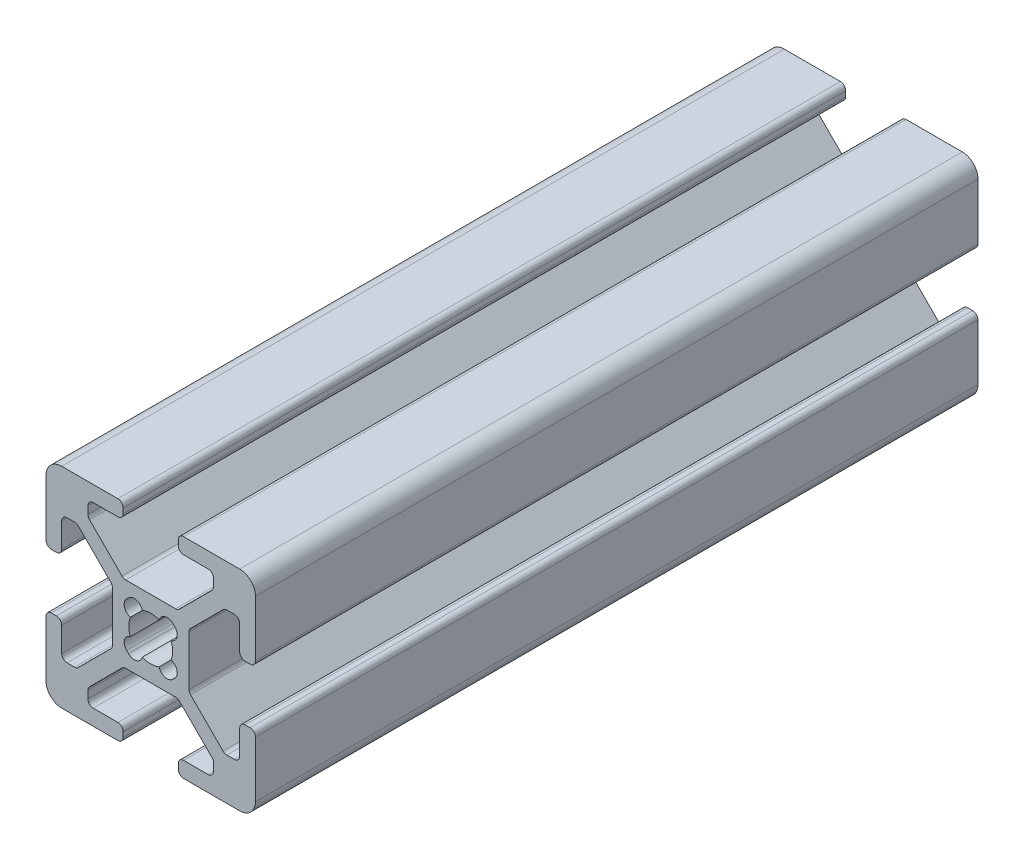
from build123d import *

# Parameters (mm, degrees)
BOSS_EXTRUDE1_DEPTH = 69


with BuildPart() as part:
    # Sketch2 → Boss-Extrude1 (new body)
    with BuildSketch(Plane.XY):
        with BuildLine():
            Line((-10, -3.138), (-10, -8.5))
            ThreePointArc((-10, -8.5), (-9.560660172, -9.560660172), (-8.5, -10))
            Line((-8.5, -10), (-3.138, -10))
            ThreePointArc((-3.138, -10), (-2.778789755, -9.851210245), (-2.63, -9.492))
            Line((-2.63, -9.492), (-2.63, -9.008))
            ThreePointArc((-2.63, -9.008), (-2.778789755, -8.648789755), (-3.138, -8.5))
            Line((-3.138, -8.5), (-5.487, -8.5))
            ThreePointArc((-5.487, -8.5), (-5.846210245, -8.351210245), (-5.995, -7.992))
            Line((-5.995, -7.992), (-5.995, -7.266240833))
            ThreePointArc((-5.995, -7.266240833), (-5.956330803, -7.07183765), (-5.846210245, -6.907030588))
            Line((-5.846210245, -6.907030588), (-2.742969412, -3.803789755))
            ThreePointArc((-2.742969412, -3.803789755), (-2.57816235, -3.693669197), (-2.383759167, -3.655))
            Line((-2.383759167, -3.655), (2.38407951, -3.655))
            ThreePointArc((2.38407951, -3.655), (2.578482694, -3.693669197), (2.743289755, -3.803789755))
            Line((2.743289755, -3.803789755), (5.846210245, -6.906710245))
            ThreePointArc((5.846210245, -6.906710245), (5.956330803, -7.071517306), (5.995, -7.26592049))
            Line((5.995, -7.26592049), (5.995, -7.992))
            ThreePointArc((5.995, -7.992), (5.846210245, -8.351210245), (5.487, -8.5))
            Line((5.487, -8.5), (3.138, -8.5))
            ThreePointArc((3.138, -8.5), (2.778789755, -8.648789755), (2.63, -9.008))
            Line((2.63, -9.008), (2.63, -9.492))
            ThreePointArc((2.63, -9.492), (2.778789755, -9.851210245), (3.138, -10))
            Line((3.138, -10), (8.5, -10))
            ThreePointArc((8.5, -10), (9.560660172, -9.560660172), (10, -8.5))
            Line((10, -8.5), (10, -3.138))
            ThreePointArc((10, -3.138), (9.851210245, -2.778789755), (9.492, -2.63))
            Line((9.492, -2.63), (9.008, -2.63))
            ThreePointArc((9.008, -2.63), (8.648789755, -2.778789755), (8.5, -3.138))
            Line((8.5, -3.138), (8.5, -5.487))
            ThreePointArc((8.5, -5.487), (8.351210245, -5.846210245), (7.992, -5.995))
            Line((7.992, -5.995), (7.266240833, -5.995))
            ThreePointArc((7.266240833, -5.995), (7.07183765, -5.956330803), (6.907030588, -5.846210245))
            Line((6.907030588, -5.846210245), (3.803789755, -2.742969412))
            ThreePointArc((3.803789755, -2.742969412), (3.693669197, -2.57816235), (3.655, -2.383759167))
            Line((3.655, -2.383759167), (3.655, 2.38407951))
            ThreePointArc((3.655, 2.38407951), (3.693669197, 2.578482694), (3.803789755, 2.743289755))
            Line((3.803789755, 2.743289755), (6.906710245, 5.846210245))
            ThreePointArc((6.906710245, 5.846210245), (7.071517306, 5.956330803), (7.26592049, 5.995))
            Line((7.26592049, 5.995), (7.992, 5.995))
            ThreePointArc((7.992, 5.995), (8.351210245, 5.846210245), (8.5, 5.487))
            Line((8.5, 5.487), (8.5, 3.138))
            ThreePointArc((8.5, 3.138), (8.648789755, 2.778789755), (9.008, 2.63))
            Line((9.008, 2.63), (9.492, 2.63))
            ThreePointArc((9.492, 2.63), (9.851210245, 2.778789755), (10, 3.138))
            Line((10, 3.138), (10, 8.5))
            ThreePointArc((10, 8.5), (9.560660172, 9.560660172), (8.5, 10))
            Line((8.5, 10), (3.138, 10))
            ThreePointArc((3.138, 10), (2.778789755, 9.851210245), (2.63, 9.492))
            Line((2.63, 9.492), (2.63, 9.008))
            ThreePointArc((2.63, 9.008), (2.778789755, 8.648789755), (3.138, 8.5))
            Line((3.138, 8.5), (5.487, 8.5))
            ThreePointArc((5.487, 8.5), (5.846210245, 8.351210245), (5.995, 7.992))
            Line((5.995, 7.992), (5.995, 7.266240833))
            ThreePointArc((5.995, 7.266240833), (5.956330803, 7.07183765), (5.846210245, 6.907030588))
            Line((5.846210245, 6.907030588), (2.742969412, 3.803789755))
            ThreePointArc((2.742969412, 3.803789755), (2.57816235, 3.693669197), (2.383759167, 3.655))
            Line((2.383759167, 3.655), (-2.38407951, 3.655))
            ThreePointArc((-2.38407951, 3.655), (-2.578482694, 3.693669197), (-2.743289755, 3.803789755))
            Line((-2.743289755, 3.803789755), (-5.846210245, 6.906710245))
            ThreePointArc((-5.846210245, 6.906710245), (-5.956330803, 7.071517306), (-5.995, 7.26592049))
            Line((-5.995, 7.26592049), (-5.995, 7.992))
            ThreePointArc((-5.995, 7.992), (-5.846210245, 8.351210245), (-5.487, 8.5))
            Line((-5.487, 8.5), (-3.138, 8.5))
            ThreePointArc((-3.138, 8.5), (-2.778789755, 8.648789755), (-2.63, 9.008))
            Line((-2.63, 9.008), (-2.63, 9.492))
            ThreePointArc((-2.63, 9.492), (-2.778789755, 9.851210245), (-3.138, 10))
            Line((-3.138, 10), (-8.5, 10))
            ThreePointArc((-8.5, 10), (-9.560660172, 9.560660172), (-10, 8.5))
            Line((-10, 8.5), (-10, 3.138))
            ThreePointArc((-10, 3.138), (-9.851210245, 2.778789755), (-9.492, 2.63))
            Line((-9.492, 2.63), (-9.008, 2.63))
            ThreePointArc((-9.008, 2.63), (-8.648789755, 2.778789755), (-8.5, 3.138))
            Line((-8.5, 3.138), (-8.5, 5.487))
            ThreePointArc((-8.5, 5.487), (-8.351210245, 5.846210245), (-7.992, 5.995))
            Line((-7.992, 5.995), (-7.266240833, 5.995))
            ThreePointArc((-7.266240833, 5.995), (-7.07183765, 5.956330803), (-6.907030588, 5.846210245))
            Line((-6.907030588, 5.846210245), (-3.803789755, 2.742969412))
            ThreePointArc((-3.803789755, 2.742969412), (-3.693669197, 2.57816235), (-3.655, 2.383759167))
            Line((-3.655, 2.383759167), (-3.655, -2.38407951))
            ThreePointArc((-3.655, -2.38407951), (-3.693669197, -2.578482694), (-3.803789755, -2.743289755))
            Line((-3.803789755, -2.743289755), (-6.906710245, -5.846210245))
            ThreePointArc((-6.906710245, -5.846210245), (-7.071517306, -5.956330803), (-7.26592049, -5.995))
            Line((-7.26592049, -5.995), (-7.992, -5.995))
            ThreePointArc((-7.992, -5.995), (-8.351210245, -5.846210245), (-8.5, -5.487))
            Line((-8.5, -5.487), (-8.5, -3.138))
            ThreePointArc((-8.5, -3.138), (-8.648789755, -2.778789755), (-9.008, -2.63))
            Line((-9.008, -2.63), (-9.492, -2.63))
            ThreePointArc((-9.492, -2.63), (-9.851210245, -2.778789755), (-10, -3.138))
        make_face()
        with BuildLine():
            Line((-2.124493037, 2.304493037), (-2.304493037, 2.124493037))
            ThreePointArc((-2.304493037, 2.124493037), (-2.506016078, 1.35638567), (-1.935777391, 0.803729988))
            ThreePointArc((-1.935777391, 0.803729988), (-2.096, 0), (-1.935777391, -0.803729988))
            ThreePointArc((-1.935777391, -0.803729988), (-2.506016078, -1.35638567), (-2.304493037, -2.124493037))
            Line((-2.304493037, -2.124493037), (-2.124493037, -2.304493037))
            ThreePointArc((-2.124493037, -2.304493037), (-1.35638567, -2.506016078), (-0.803729988, -1.935777391))
            ThreePointArc((-0.803729988, -1.935777391), (0, -2.096), (0.803729988, -1.935777391))
            ThreePointArc((0.803729988, -1.935777391), (1.35638567, -2.506016078), (2.124493037, -2.304493037))
            Line((2.124493037, -2.304493037), (2.304493037, -2.124493037))
            ThreePointArc((2.304493037, -2.124493037), (2.506016078, -1.35638567), (1.935777391, -0.803729988))
            ThreePointArc((1.935777391, -0.803729988), (2.096, 0), (1.935777391, 0.803729988))
            ThreePointArc((1.935777391, 0.803729988), (2.506016078, 1.35638567), (2.304493037, 2.124493037))
            Line((2.304493037, 2.124493037), (2.124493037, 2.304493037))
            ThreePointArc((2.124493037, 2.304493037), (1.35638567, 2.506016078), (0.803729988, 1.935777391))
            ThreePointArc((0.803729988, 1.935777391), (0, 2.096), (-0.803729988, 1.935777391))
            ThreePointArc((-0.803729988, 1.935777391), (-1.35638567, 2.506016078), (-2.124493037, 2.304493037))
        make_face(mode=Mode.SUBTRACT)
    extrude(amount=-BOSS_EXTRUDE1_DEPTH)


solid = part.part
